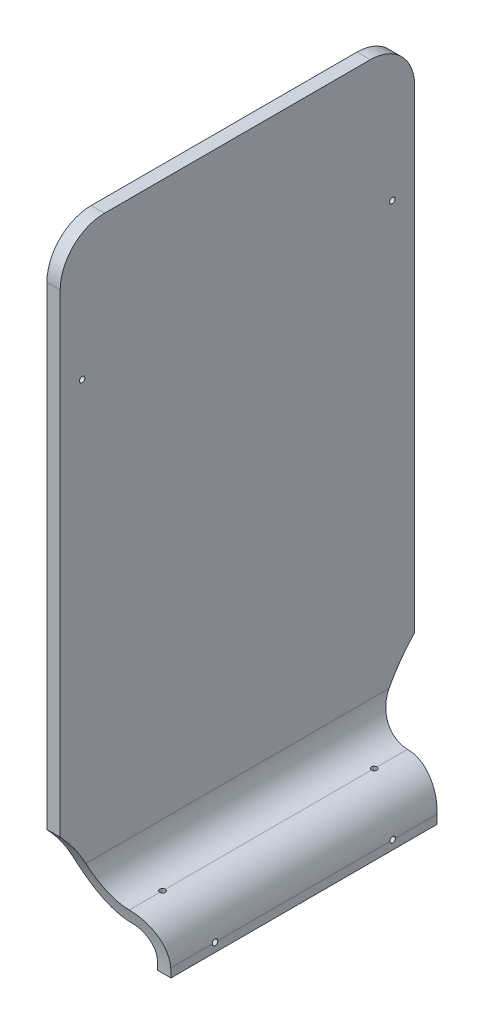
from build123d import *

# Parameters (mm, degrees)
EXTRUDE_THIN1_DEPTH     = 101.6
FILLET1_R               = 25.4
FILLET2_R               = 25.4
CUT_EXTRUDE1_DEPTH      = 10.922
CUT_EXTRUDE1_DEPTH_BACK = 54.61
CUT_EXTRUDE2_DEPTH      = 14.224
CUT_EXTRUDE2_DEPTH_BACK = 17.78
SKETCH4_R               = 1.5875
CUT_EXTRUDE3_DEPTH      = 14.732
CUT_EXTRUDE3_DEPTH_BACK = 23.876
SKETCH5_R               = 1.5875
CUT_EXTRUDE5_DEPTH      = 15.24
CUT_EXTRUDE5_DEPTH_BACK = 39.37
SKETCH6_R               = 1.5875


with BuildPart() as part:
    # Sketch1 → Extrude-Thin1 (new, symmetric)
    with BuildSketch(Plane.XY):
        with BuildLine():
            Line((0, 0), (0, 5.08))
            ThreePointArc((0, 5.08), (-3.719743879, 14.060256121), (-12.7, 17.78))
            ThreePointArc((-12.7, 17.78), (-30.660512242, 25.219487758), (-38.1, 43.18))
            Line((-38.1, 43.18), (-38.1, 360.68))
            Line((-38.1, 360.68), (-30.48, 360.68))
            Line((-30.48, 360.68), (-30.48, 43.18))
            ThreePointArc((-30.48, 43.18), (-25.272358569, 30.607641431), (-12.7, 25.4))
            ThreePointArc((-12.7, 25.4), (1.668409794, 19.448409794), (7.62, 5.08))
            Line((7.62, 5.08), (7.62, 0))
            Line((7.62, 0), (0, 0))
        make_face()
    extrude(amount=EXTRUDE_THIN1_DEPTH, both=True)

    # Fillet1
    fillet1_edges = [part.edges().sort_by_distance(p)[0] for p in [
        (-34.29, 360.68, 101.6),
    ]]
    fillet(fillet1_edges, radius=FILLET1_R)

    # Fillet2
    fillet2_edges = [part.edges().sort_by_distance(p)[0] for p in [
        (-34.29, 360.68, -101.6),
    ]]
    fillet(fillet2_edges, radius=FILLET2_R)

    # Sketch3 → Cut-Extrude1 (cut, two sides: drawn at the far end of the back side and taken through both)
    with BuildSketch(Plane(origin=(7.62, 0, 0), x_dir=(0, 0, -1), z_dir=(1, 0, 0)).offset(-CUT_EXTRUDE1_DEPTH_BACK)):
        with BuildLine():
            Line((-101.6, 0), (-101.6, 63.533291796))
            ThreePointArc((-101.6, 63.533291796), (-82.785279567, 34.211252412), (-76.2, 0))
            Line((-76.2, 0), (-101.6, 0))
        make_face()
        with BuildLine():
            Line((101.6, 0), (76.2, 0))
            ThreePointArc((76.2, 0), (82.785279567, 34.211252412), (101.6, 63.533291796))
            Line((101.6, 63.533291796), (101.6, 0))
        make_face()
    extrude(amount=CUT_EXTRUDE1_DEPTH + CUT_EXTRUDE1_DEPTH_BACK, mode=Mode.SUBTRACT)

    # Sketch4 → Cut-Extrude2 (cut, two sides: drawn at the far end of the back side and taken through both)
    with BuildSketch(Plane(origin=(-30.48, 0, 0), x_dir=(0, 0, -1), z_dir=(1, 0, 0)).offset(-CUT_EXTRUDE2_DEPTH_BACK)):
        with Locations(Location((-89.003908419, 284.48, 0), (0, 0, 180))):
            Circle(SKETCH4_R)
        with Locations(Location((88.803751124, 284.48, 0), (0, 0, 180))):
            Circle(SKETCH4_R)
    extrude(amount=CUT_EXTRUDE2_DEPTH + CUT_EXTRUDE2_DEPTH_BACK, mode=Mode.SUBTRACT)

    # Sketch5 → Cut-Extrude3 (cut, two sides: drawn at the far end of the back side and taken through both)
    with BuildSketch(Plane(origin=(0, 25.4, 0), x_dir=(1, 0, 0), z_dir=(0, 1, 0)).offset(-CUT_EXTRUDE3_DEPTH_BACK)):
        with Locations(Location((-12.7, -60.719407292, 0), (0, 0, 90))):
            Circle(SKETCH5_R)
        with Locations(Location((-12.7, 60.719407292, 0), (0, 0, 90))):
            Circle(SKETCH5_R)
    extrude(amount=CUT_EXTRUDE3_DEPTH + CUT_EXTRUDE3_DEPTH_BACK, mode=Mode.SUBTRACT)

    # Sketch6 → Cut-Extrude5 (cut, two sides: drawn at the far end of the back side and taken through both)
    with BuildSketch(Plane(origin=(7.62, 0, 0), x_dir=(0, 0, -1), z_dir=(1, 0, 0)).offset(-CUT_EXTRUDE5_DEPTH_BACK)):
        with Locations(Location((-50.940117855, 5.08, 0), (0, 0, 180))):
            Circle(SKETCH6_R)
        with Locations(Location((50.940117855, 5.08, 0), (0, 0, 180))):
            Circle(SKETCH6_R)
    extrude(amount=CUT_EXTRUDE5_DEPTH + CUT_EXTRUDE5_DEPTH_BACK, mode=Mode.SUBTRACT)


solid = part.part
